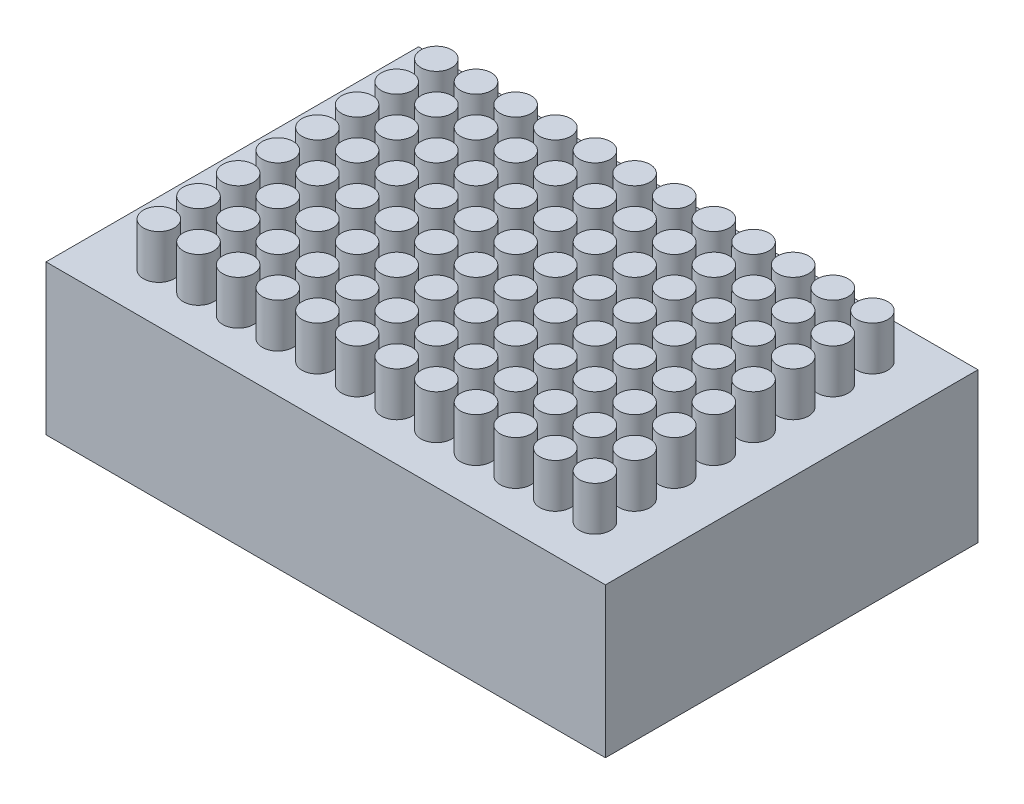
from build123d import *

# Parameters (mm, degrees)
SKETCH1_W           = 127
SKETCH1_H           = 84.582
BOSS_EXTRUDE1_DEPTH = 34
SKETCH4_R           = 3.5
BOSS_EXTRUDE2_DEPTH = 10


with BuildPart() as part:
    # Sketch1 → Boss-Extrude1 (new body)
    with BuildSketch(Plane(origin=(0, 0, 0), x_dir=(1, 0, 0), z_dir=(0, 1, 0))):
        with Locations((63.5, 42.291)):
            Rectangle(SKETCH1_W, SKETCH1_H)
    extrude(amount=BOSS_EXTRUDE1_DEPTH)

    # Sketch4 → Boss-Extrude2 (add)
    with BuildSketch(Plane(origin=(0, 34, 0), x_dir=(1, 0, 0), z_dir=(0, 1, 0))):
        with Locations(Location((104.38, 11.24, 0), (0, 0, 90))):
            Circle(SKETCH4_R)
        with Locations(Location((95.38, 11.24, 0), (0, 0, 90))):
            Circle(SKETCH4_R)
        with Locations(Location((86.38, 11.24, 0), (0, 0, 90))):
            Circle(SKETCH4_R)
        with Locations(Location((77.38, 11.24, 0), (0, 0, 90))):
            Circle(SKETCH4_R)
        with Locations(Location((68.38, 11.24, 0), (0, 0, 90))):
            Circle(SKETCH4_R)
        with Locations(Location((59.38, 11.24, 0), (0, 0, 90))):
            Circle(SKETCH4_R)
        with Locations(Location((50.38, 11.24, 0), (0, 0, 90))):
            Circle(SKETCH4_R)
        with Locations(Location((41.38, 11.24, 0), (0, 0, 90))):
            Circle(SKETCH4_R)
        with Locations(Location((32.38, 11.24, 0), (0, 0, 90))):
            Circle(SKETCH4_R)
        with Locations(Location((23.38, 11.24, 0), (0, 0, 90))):
            Circle(SKETCH4_R)
        with Locations(Location((14.38, 11.24, 0), (0, 0, 90))):
            Circle(SKETCH4_R)
        with Locations(Location((113.38, 20.24, 0), (0, 0, 90))):
            Circle(SKETCH4_R)
        with Locations(Location((104.38, 20.24, 0), (0, 0, 90))):
            Circle(SKETCH4_R)
        with Locations(Location((95.38, 20.24, 0), (0, 0, 90))):
            Circle(SKETCH4_R)
        with Locations(Location((86.38, 20.24, 0), (0, 0, 90))):
            Circle(SKETCH4_R)
        with Locations(Location((77.38, 20.24, 0), (0, 0, 90))):
            Circle(SKETCH4_R)
        with Locations(Location((68.38, 20.24, 0), (0, 0, 90))):
            Circle(SKETCH4_R)
        with Locations(Location((59.38, 20.24, 0), (0, 0, 90))):
            Circle(SKETCH4_R)
        with Locations(Location((50.38, 20.24, 0), (0, 0, 90))):
            Circle(SKETCH4_R)
        with Locations(Location((41.38, 20.24, 0), (0, 0, 90))):
            Circle(SKETCH4_R)
        with Locations(Location((32.38, 20.24, 0), (0, 0, 90))):
            Circle(SKETCH4_R)
        with Locations(Location((23.38, 20.24, 0), (0, 0, 90))):
            Circle(SKETCH4_R)
        with Locations(Location((14.38, 20.24, 0), (0, 0, 90))):
            Circle(SKETCH4_R)
        with Locations(Location((113.38, 29.24, 0), (0, 0, 90))):
            Circle(SKETCH4_R)
        with Locations(Location((104.38, 29.24, 0), (0, 0, 90))):
            Circle(SKETCH4_R)
        with Locations(Location((95.38, 29.24, 0), (0, 0, 90))):
            Circle(SKETCH4_R)
        with Locations(Location((113.38, 11.24, 0), (0, 0, 90))):
            Circle(SKETCH4_R)
        with Locations(Location((86.38, 29.24, 0), (0, 0, 90))):
            Circle(SKETCH4_R)
        with Locations(Location((77.38, 29.24, 0), (0, 0, 90))):
            Circle(SKETCH4_R)
        with Locations(Location((68.38, 29.24, 0), (0, 0, 90))):
            Circle(SKETCH4_R)
        with Locations(Location((59.38, 29.24, 0), (0, 0, 90))):
            Circle(SKETCH4_R)
        with Locations(Location((50.38, 29.24, 0), (0, 0, 90))):
            Circle(SKETCH4_R)
        with Locations(Location((41.38, 29.24, 0), (0, 0, 90))):
            Circle(SKETCH4_R)
        with Locations(Location((32.38, 29.24, 0), (0, 0, 90))):
            Circle(SKETCH4_R)
        with Locations(Location((23.38, 29.24, 0), (0, 0, 90))):
            Circle(SKETCH4_R)
        with Locations(Location((14.38, 29.24, 0), (0, 0, 90))):
            Circle(SKETCH4_R)
        with Locations(Location((113.38, 38.24, 0), (0, 0, 90))):
            Circle(SKETCH4_R)
        with Locations(Location((104.38, 38.24, 0), (0, 0, 90))):
            Circle(SKETCH4_R)
        with Locations(Location((95.38, 38.24, 0), (0, 0, 90))):
            Circle(SKETCH4_R)
        with Locations(Location((86.38, 38.24, 0), (0, 0, 90))):
            Circle(SKETCH4_R)
        with Locations(Location((77.38, 38.24, 0), (0, 0, 90))):
            Circle(SKETCH4_R)
        with Locations(Location((68.38, 38.24, 0), (0, 0, 90))):
            Circle(SKETCH4_R)
        with Locations(Location((59.38, 38.24, 0), (0, 0, 90))):
            Circle(SKETCH4_R)
        with Locations(Location((50.38, 38.24, 0), (0, 0, 90))):
            Circle(SKETCH4_R)
        with Locations(Location((41.38, 38.24, 0), (0, 0, 90))):
            Circle(SKETCH4_R)
        with Locations(Location((32.38, 38.24, 0), (0, 0, 90))):
            Circle(SKETCH4_R)
        with Locations(Location((23.38, 38.24, 0), (0, 0, 90))):
            Circle(SKETCH4_R)
        with Locations(Location((14.38, 38.24, 0), (0, 0, 90))):
            Circle(SKETCH4_R)
        with Locations(Location((113.38, 47.24, 0), (0, 0, 90))):
            Circle(SKETCH4_R)
        with Locations(Location((104.38, 47.24, 0), (0, 0, 90))):
            Circle(SKETCH4_R)
        with Locations(Location((95.38, 47.24, 0), (0, 0, 90))):
            Circle(SKETCH4_R)
        with Locations(Location((86.38, 47.24, 0), (0, 0, 90))):
            Circle(SKETCH4_R)
        with Locations(Location((77.38, 47.24, 0), (0, 0, 90))):
            Circle(SKETCH4_R)
        with Locations(Location((68.38, 47.24, 0), (0, 0, 90))):
            Circle(SKETCH4_R)
        with Locations(Location((59.38, 47.24, 0), (0, 0, 90))):
            Circle(SKETCH4_R)
        with Locations(Location((50.38, 47.24, 0), (0, 0, 90))):
            Circle(SKETCH4_R)
        with Locations(Location((41.38, 47.24, 0), (0, 0, 90))):
            Circle(SKETCH4_R)
        with Locations(Location((32.38, 47.24, 0), (0, 0, 90))):
            Circle(SKETCH4_R)
        with Locations(Location((23.38, 47.24, 0), (0, 0, 90))):
            Circle(SKETCH4_R)
        with Locations(Location((14.38, 47.24, 0), (0, 0, 90))):
            Circle(SKETCH4_R)
        with Locations(Location((113.38, 56.24, 0), (0, 0, 90))):
            Circle(SKETCH4_R)
        with Locations(Location((104.38, 56.24, 0), (0, 0, 90))):
            Circle(SKETCH4_R)
        with Locations(Location((95.38, 56.24, 0), (0, 0, 90))):
            Circle(SKETCH4_R)
        with Locations(Location((86.38, 56.24, 0), (0, 0, 90))):
            Circle(SKETCH4_R)
        with Locations(Location((77.38, 56.24, 0), (0, 0, 90))):
            Circle(SKETCH4_R)
        with Locations(Location((68.38, 56.24, 0), (0, 0, 90))):
            Circle(SKETCH4_R)
        with Locations(Location((59.38, 56.24, 0), (0, 0, 90))):
            Circle(SKETCH4_R)
        with Locations(Location((50.38, 56.24, 0), (0, 0, 90))):
            Circle(SKETCH4_R)
        with Locations(Location((41.38, 56.24, 0), (0, 0, 90))):
            Circle(SKETCH4_R)
        with Locations(Location((32.38, 56.24, 0), (0, 0, 90))):
            Circle(SKETCH4_R)
        with Locations(Location((23.38, 56.24, 0), (0, 0, 90))):
            Circle(SKETCH4_R)
        with Locations(Location((14.38, 56.24, 0), (0, 0, 90))):
            Circle(SKETCH4_R)
        with Locations(Location((113.38, 65.24, 0), (0, 0, 90))):
            Circle(SKETCH4_R)
        with Locations(Location((104.38, 65.24, 0), (0, 0, 90))):
            Circle(SKETCH4_R)
        with Locations(Location((95.38, 65.24, 0), (0, 0, 90))):
            Circle(SKETCH4_R)
        with Locations(Location((86.38, 65.24, 0), (0, 0, 90))):
            Circle(SKETCH4_R)
        with Locations(Location((77.38, 65.24, 0), (0, 0, 90))):
            Circle(SKETCH4_R)
        with Locations(Location((68.38, 65.24, 0), (0, 0, 90))):
            Circle(SKETCH4_R)
        with Locations(Location((59.38, 65.24, 0), (0, 0, 90))):
            Circle(SKETCH4_R)
        with Locations(Location((50.38, 65.24, 0), (0, 0, 90))):
            Circle(SKETCH4_R)
        with Locations(Location((41.38, 65.24, 0), (0, 0, 90))):
            Circle(SKETCH4_R)
        with Locations(Location((32.38, 65.24, 0), (0, 0, 90))):
            Circle(SKETCH4_R)
        with Locations(Location((23.38, 65.24, 0), (0, 0, 90))):
            Circle(SKETCH4_R)
        with Locations(Location((14.38, 65.24, 0), (0, 0, 90))):
            Circle(SKETCH4_R)
        with Locations(Location((113.38, 74.24, 0), (0, 0, 90))):
            Circle(SKETCH4_R)
        with Locations(Location((104.38, 74.24, 0), (0, 0, 90))):
            Circle(SKETCH4_R)
        with Locations(Location((95.38, 74.24, 0), (0, 0, 90))):
            Circle(SKETCH4_R)
        with Locations(Location((86.38, 74.24, 0), (0, 0, 90))):
            Circle(SKETCH4_R)
        with Locations(Location((77.38, 74.24, 0), (0, 0, 90))):
            Circle(SKETCH4_R)
        with Locations(Location((68.38, 74.24, 0), (0, 0, 90))):
            Circle(SKETCH4_R)
        with Locations(Location((59.38, 74.24, 0), (0, 0, 90))):
            Circle(SKETCH4_R)
        with Locations(Location((50.38, 74.24, 0), (0, 0, 90))):
            Circle(SKETCH4_R)
        with Locations(Location((41.38, 74.24, 0), (0, 0, 90))):
            Circle(SKETCH4_R)
        with Locations(Location((32.38, 74.24, 0), (0, 0, 90))):
            Circle(SKETCH4_R)
        with Locations(Location((23.38, 74.24, 0), (0, 0, 90))):
            Circle(SKETCH4_R)
        with Locations(Location((14.38, 74.24, 0), (0, 0, 90))):
            Circle(SKETCH4_R)
    extrude(amount=BOSS_EXTRUDE2_DEPTH)


solid = part.part
